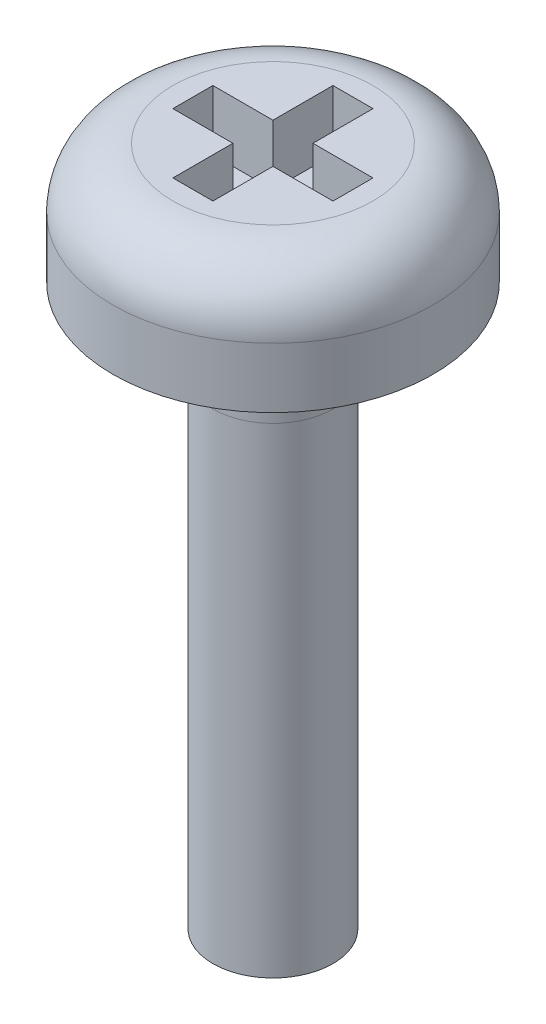
from build123d import *

# Parameters (mm, degrees)
SKETCH3_R           = 0.75
BOSS_EXTRUDE1_DEPTH = 7
SKETCH4_R           = 2
BOSS_EXTRUDE2_DEPTH = 1.5
FILLET3_R           = 0.75
CUT_EXTRUDE4_DEPTH  = 0.75


with BuildPart() as part:
    # Sketch3 → Boss-Extrude1 (new body)
    with BuildSketch(Plane(origin=(0, 0, 0), x_dir=(1, 0, 0), z_dir=(0, 1, 0))):
        with Locations(Location((0, 0, 0), (0, 0, 270))):
            Circle(SKETCH3_R)
    extrude(amount=BOSS_EXTRUDE1_DEPTH)

    # Sketch4 → Boss-Extrude2 (add)
    with BuildSketch(Plane(origin=(0, 7, 0), x_dir=(1, 0, 0), z_dir=(0, 1, 0))):
        with Locations(Location((0, 0, 0), (0, 0, 270))):
            Circle(SKETCH4_R)
    extrude(amount=BOSS_EXTRUDE2_DEPTH)

    # Fillet3
    fillet3_edges = [part.edges().sort_by_distance(p)[0] for p in [
        (0, 8.5, -2),
    ]]
    fillet(fillet3_edges, radius=FILLET3_R)

    # Sketch6 → Cut-Extrude4 (cut)
    with BuildSketch(Plane(origin=(0, 8.5, 0), x_dir=(1, 0, 0), z_dir=(0, 1, 0))):
        Polygon((0.25, 0.25), (1, 0.25), (1, -0.25), (0.25, -0.25), (0.25, -1), (-0.25, -1), (-0.25, -0.25), (-1, -0.25), (-1, 0.25), (-0.25, 0.25), (-0.25, 1), (0.25, 1), align=None)
    extrude(amount=-CUT_EXTRUDE4_DEPTH, mode=Mode.SUBTRACT)


solid = part.part
